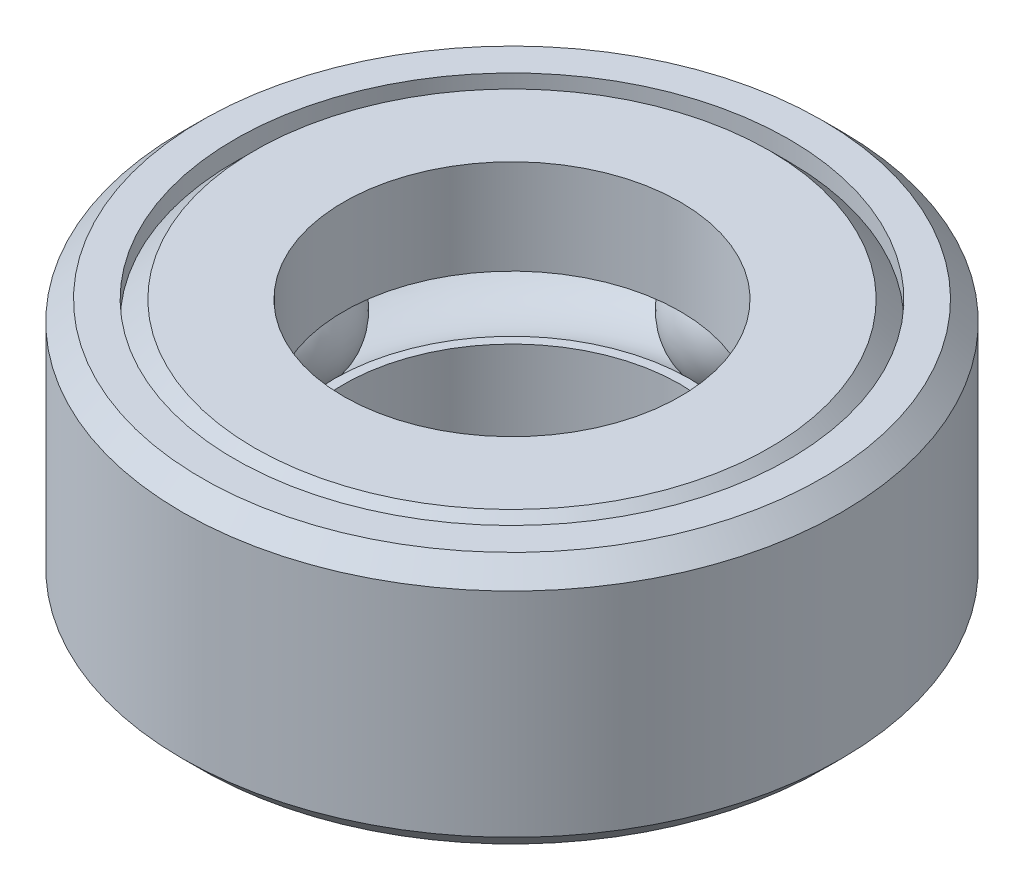
from build123d import *

# Parameters (mm, degrees)
CIRPATTERN1_COUNT = 4


with BuildPart() as part:
    # Sketch2 → Revolve1 (revolve)
    with BuildSketch(Plane(origin=(0, 0, 0), x_dir=(0, 0, -1), z_dir=(1, 0, 0)), mode=Mode.PRIVATE) as revolve1_sk:
        with BuildLine():
            Line((-16.249740739, 1.7859375), (-16.7878125, 1.7859375))
            Line((-16.7878125, 1.7859375), (-16.7878125, 4.924471398))
            Line((-16.7878125, 4.924471398), (-14.568533898, 7.14375))
            Line((-14.568533898, 7.14375), (-9.525, 7.14375))
            Line((-9.525, 7.14375), (-9.525, 1.7859375))
            Line((-9.525, 1.7859375), (-10.063071761, 1.7859375))
            ThreePointArc((-10.063071761, 1.7859375), (-13.15640625, 3.571875), (-16.249740739, 1.7859375))
        make_face()
        with BuildLine():
            Line((-9.525, -1.7859375), (-10.063071761, -1.7859375))
            ThreePointArc((-10.063071761, -1.7859375), (-13.15640625, -3.571875), (-16.249740739, -1.7859375))
            Line((-16.249740739, -1.7859375), (-16.7878125, -1.7859375))
            Line((-16.7878125, -1.7859375), (-16.7878125, -4.924471398))
            Line((-16.7878125, -4.924471398), (-14.568533898, -7.14375))
            Line((-14.568533898, -7.14375), (-9.525, -7.14375))
            Line((-9.525, -7.14375), (-9.525, -1.7859375))
        make_face()
    revolve(revolve1_sk.sketch.rotate(Axis((0, -7.14375, 0), (0, 1, 0)), 180), axis=Axis((0, -7.14375, 0), (0, 1, 0)))


with BuildPart() as body_2:
    # Sketch3 → Revolve2 (revolve)
    with BuildSketch(Plane(origin=(0, 0, 0), x_dir=(0, 0, -1), z_dir=(1, 0, 0)), mode=Mode.PRIVATE) as revolve2_sk:
        Polygon((-15.678173199, 6.034110699), (-15.678173199, 7.14375), (-17.543485699, 7.14375), (-18.653125, 6.034110699), (-18.653125, -6.034110699), (-17.543485699, -7.14375), (-15.678173199, -7.14375), (-15.678173199, -6.034110699), (-16.7878125, -4.924471398), (-16.7878125, 4.924471398), align=None)
    revolve(revolve2_sk.sketch.rotate(Axis((0, -7.14375, 0), (0, 1, 0)), 180), axis=Axis((0, -7.14375, 0), (0, 1, 0)))


with BuildPart() as body_3:
    # Sketch4 → Revolve3 (revolve)
    with BuildSketch(Plane(origin=(0, 0, 0), x_dir=(0, 0, -1), z_dir=(1, 0, 0))):
        with BuildLine():
            Line((-13.15640625, 3.571875), (-13.15640625, -3.571875))
            ThreePointArc((-13.15640625, -3.571875), (-9.58453125, 0), (-13.15640625, 3.571875))
        make_face()
    revolve(axis=Axis((0, 3.571875, 13.15640625), (0, -1, 0)))


with BuildPart() as cirpattern1_1:
    # CirPattern1: pattern copy
    add(body_3.part.rotate(Axis((0, 0, 0), (0, 1, 0)), 1 * 360 / CIRPATTERN1_COUNT))


with BuildPart() as cirpattern1_2:
    # CirPattern1: pattern copy
    add(body_3.part.rotate(Axis((0, 0, 0), (0, 1, 0)), 2 * 360 / CIRPATTERN1_COUNT))


with BuildPart() as cirpattern1_3:
    # CirPattern1: pattern copy
    add(body_3.part.rotate(Axis((0, 0, 0), (0, 1, 0)), 3 * 360 / CIRPATTERN1_COUNT))


solid = Compound([part.part, body_2.part, body_3.part, cirpattern1_1.part, cirpattern1_2.part, cirpattern1_3.part])
